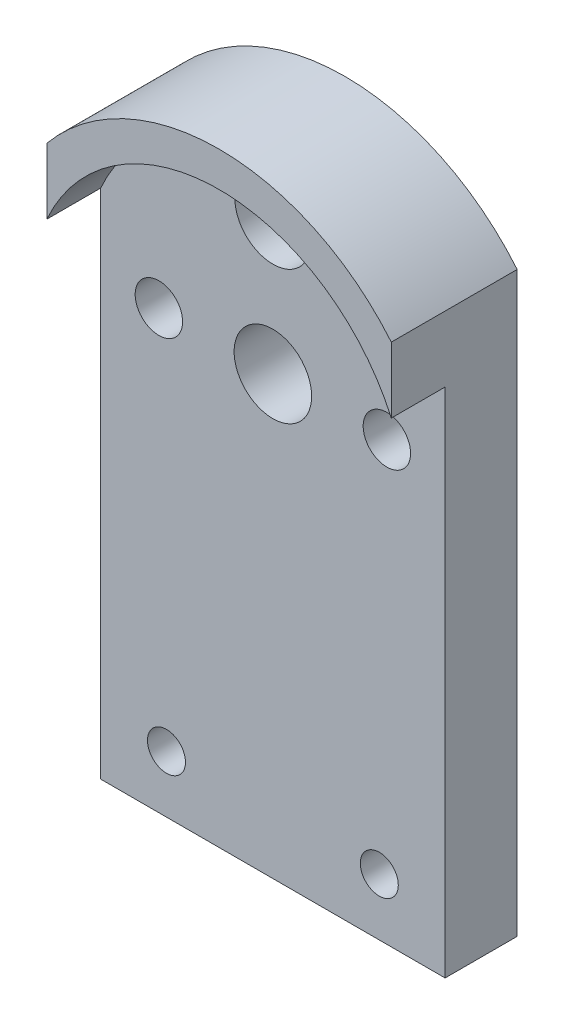
from build123d import *

# Parameters (mm, degrees)
SKETCH2_R                            = 3.2385
BOSS_EXTRUDE1_DEPTH                  = 6.0198
BOSS_EXTRUDE5_DEPTH                  = 4.4958
SKETCH5_R                            = 1.9812
CUT_EXTRUDE2_ENCODERSCREWHOLES_DEPTH = 40.704494042
CUT_EXTRUDE4_DEPTH                   = 2.8448
SKETCH13_R                           = 1.5875
CUT_EXTRUDE5_DEPTH                   = 40.704494042
SKETCH7_R                            = 3.96875
BOSS_EXTRUDE4_DEPTH                  = 3.175
SKETCH14_R                           = 3.175
CUT_EXTRUDE6_DEPTH                   = 41.629874457


with BuildPart() as part:
    # Sketch2 → Boss-Extrude1 (new body)
    with BuildSketch(Plane.XY):
        with BuildLine():
            Line((14.3891, -36.5125), (-14.3891, -36.5125))
            Line((-14.3891, -36.5125), (-14.3891, 11.742361964))
            ThreePointArc((-14.3891, 11.742361964), (0, 18.5166), (14.3891, 11.742361964))
            Line((14.3891, 11.742361964), (14.3891, -36.5125))
        make_face()
        Circle(SKETCH2_R, mode=Mode.SUBTRACT)
    extrude(amount=BOSS_EXTRUDE1_DEPTH)

    # Sketch12 → Boss-Extrude5 (add)
    with BuildSketch(Plane.XY.offset(6.0198)):
        with BuildLine():
            Line((-14.3891, 6.247076947), (-14.3891, 11.742361964))
            ThreePointArc((-14.3891, 11.742361964), (0, 18.5166), (14.3891, 11.742361964))
            Line((14.3891, 11.742361964), (14.3891, 6.247076947))
            ThreePointArc((14.3891, 6.247076947), (0, 15.5956), (-14.3891, 6.247076947))
        make_face()
    extrude(amount=BOSS_EXTRUDE5_DEPTH)

    # Sketch5 → Cut-Extrude2_EncoderScrewHoles (cut, through all)
    with BuildSketch(Plane.XY.offset(6.0198)):
        with Locations((-9.525, 0)):
            Circle(SKETCH5_R)
        with Locations((9.525, 0)):
            Circle(SKETCH5_R)
    extrude(amount=-CUT_EXTRUDE2_ENCODERSCREWHOLES_DEPTH, mode=Mode.SUBTRACT)

    # Sketch11 → Cut-Extrude4 (cut)
    with BuildSketch(Plane(origin=(0, 0, 0), x_dir=(-1, 0, 0), z_dir=(0, 0, -1))):
        Polygon((9.525, -3.372880273), (12.446, -1.686440136), (12.446, 1.686440136), (9.525, 3.372880273), (6.604, 1.686440136), (6.604, -1.686440136), align=None)
        Polygon((-6.604, -1.686440136), (-6.604, 1.686440136), (-9.525, 3.372880273), (-12.446, 1.686440136), (-12.446, -1.686440136), (-9.525, -3.372880273), align=None)
    extrude(amount=-CUT_EXTRUDE4_DEPTH, mode=Mode.SUBTRACT)

    # Sketch13 → Cut-Extrude5 (cut, through all)
    with BuildSketch(Plane.XY.offset(6.0198)):
        with Locations((8.89, -31.75)):
            Circle(SKETCH13_R)
        with Locations((-8.89, -31.75)):
            Circle(SKETCH13_R)
    extrude(amount=-CUT_EXTRUDE5_DEPTH, mode=Mode.SUBTRACT)

    # Sketch7 → Boss-Extrude4 (add)
    with BuildSketch(Plane(origin=(0, 0, 0), x_dir=(-1, 0, 0), z_dir=(0, 0, -1))):
        with Locations((0, -15.875)):
            Circle(SKETCH7_R)
    extrude(amount=BOSS_EXTRUDE4_DEPTH)

    # Sketch14 → Cut-Extrude6 (cut, through all)
    with BuildSketch(Plane(origin=(0, 0, 0), x_dir=(-1, 0, 0), z_dir=(0, 0, -1))):
        with Locations((0, 11.1125)):
            Circle(SKETCH14_R)
    extrude(amount=-CUT_EXTRUDE6_DEPTH, mode=Mode.SUBTRACT)


solid = part.part
